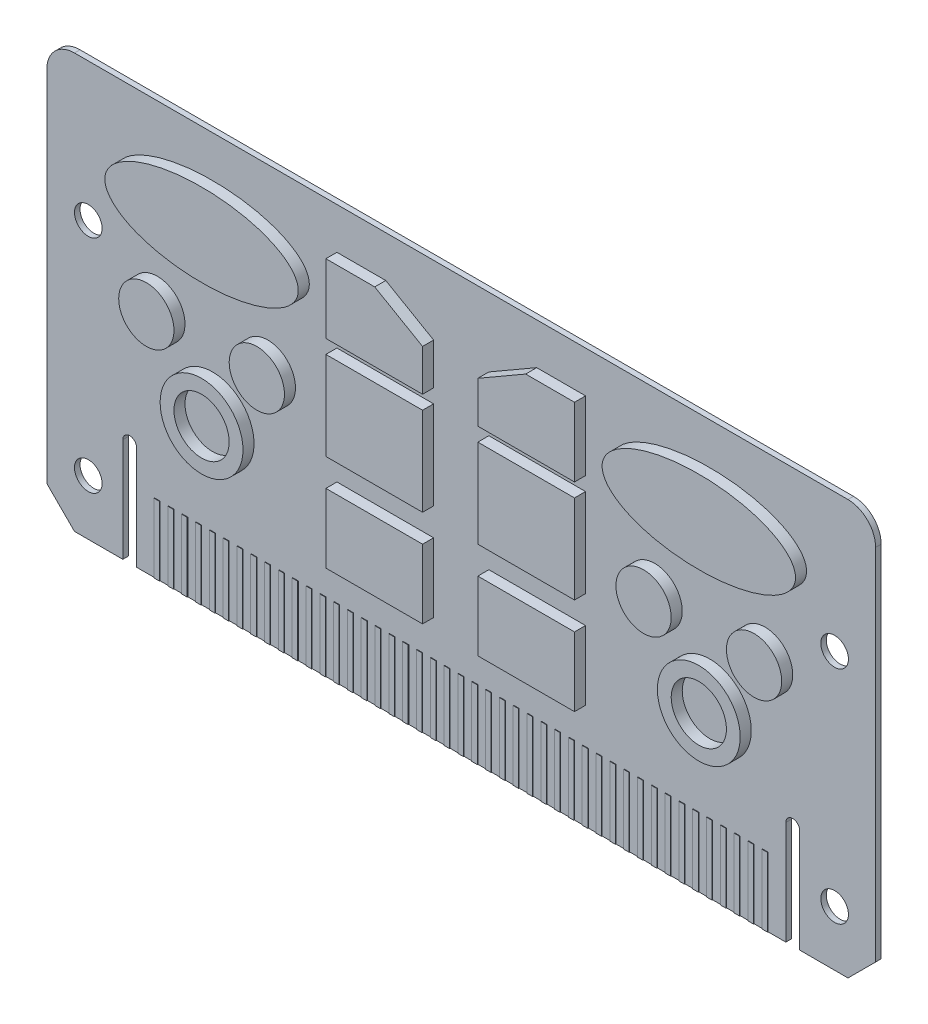
from build123d import *

# Parameters (mm, degrees)
SKETCH4_W                  = 300
SKETCH4_H                  = 150
PCB_BASE_DEPTH             = 1
SKETCH5_R                  = 10
SKETCH5_R_2                = 15
SKETCH5_RX                 = 35
SKETCH5_RY                 = 15
SKETCH5_W                  = 35
SKETCH5_H                  = 25
SKETCH5_H_2                = 32
PCB_CHIPS_DEPTH            = 4
SLOT_CUT_DEPTH             = 10
F_10_0MM_DOWEL_HOLE1_D     = 10
F_10_0MM_DOWEL_HOLE1_DEPTH = 10
F_10_0MM_DOWEL_HOLE1_TIP   = 3.004303095
SKETCH11_W                 = 2
SKETCH11_H                 = 25
CONTACT_DEPTH              = 0.2
CONTACT_PATTERN_COUNT      = 45
CONTACT_PATTERN_PITCH      = 5
CHAMFER1_SIZE              = 10
FILLET1_R                  = 10


with BuildPart() as part:
    # Sketch4 → PCB Base (new, symmetric)
    with BuildSketch(Plane.XY):
        with Locations((-150, 75)):
            Rectangle(SKETCH4_W, SKETCH4_H)
    extrude(amount=PCB_BASE_DEPTH, both=True)

    # Sketch5 → PCB Chips (add)
    # profile 1 of 14: a face of its own
    with BuildSketch(Plane.XY.offset(1)):
        with Locations(Location((-260, 85, 0), (0, 0, 180))):
            Circle(SKETCH5_R)
    # profile 2 of 14: a face of its own
    with BuildSketch(Plane.XY.offset(1)):
        with Locations(Location((-220, 85, 0), (0, 0, 180))):
            Circle(SKETCH5_R)
    # profile 3 of 14: a face of its own
    with BuildSketch(Plane.XY.offset(1)):
        with Locations(Location((-240, 60, 0), (0, 0, 180))):
            Circle(SKETCH5_R_2)
        with Locations((-240, 60)):
            Circle(SKETCH5_R, mode=Mode.SUBTRACT)
    # profile 4 of 14: a face of its own
    with BuildSketch(Plane.XY.offset(1)):
        with Locations(Location((-60, 60, 0), (0, 0, 180))):
            Circle(SKETCH5_R_2)
        with Locations(Location((-60, 60, 0), (0, 0, 180))):
            Circle(SKETCH5_R, mode=Mode.SUBTRACT)
    # profile 5 of 14: a face of its own
    with BuildSketch(Plane.XY.offset(1)):
        with Locations(Location((-80, 85, 0), (0, 0, 180))):
            Circle(SKETCH5_R)
    # profile 6 of 14: a face of its own
    with BuildSketch(Plane.XY.offset(1)):
        with Locations(Location((-40, 85, 0), (0, 0, 180))):
            Circle(SKETCH5_R)
    # profile 7 of 14: a face of its own
    with BuildSketch(Plane.XY.offset(1)):
        with Locations(Location((-240, 120), (0, 0, 180))):
            Ellipse(SKETCH5_RX, SKETCH5_RY)
    # profile 8 of 14: a face of its own
    with BuildSketch(Plane.XY.offset(1)):
        with Locations((-60, 120)):
            Ellipse(SKETCH5_RX, SKETCH5_RY)
    # profile 9 of 14: a face of its own
    with BuildSketch(Plane.XY.offset(1)):
        with Locations((-177.5, 50.5)):
            Rectangle(SKETCH5_W, SKETCH5_H)
    # profile 10 of 14: a face of its own
    with BuildSketch(Plane.XY.offset(1)):
        with Locations((-177.5, 89)):
            Rectangle(SKETCH5_W, SKETCH5_H_2)
    # profile 11 of 14: a face of its own
    with BuildSketch(Plane.XY.offset(1)):
        Polygon((-195, 110), (-160, 110), (-160, 125), (-177.320508076, 135), (-195, 135), align=None)
    # profile 12 of 14: a face of its own
    with BuildSketch(Plane.XY.offset(1)):
        Polygon((-140, 110), (-140, 125), (-122.679491924, 135), (-105, 135), (-105, 110), align=None)
    # profile 13 of 14: a face of its own
    with BuildSketch(Plane.XY.offset(1)):
        with Locations((-122.5, 50.5)):
            Rectangle(SKETCH5_W, SKETCH5_H)
    # profile 14 of 14: a face of its own
    with BuildSketch(Plane.XY.offset(1)):
        with Locations((-122.5, 89)):
            Rectangle(SKETCH5_W, SKETCH5_H_2)
    pcb_chips = extrude(amount=PCB_CHIPS_DEPTH)

    # Mirror1: PCB Chips across plane
    add(pcb_chips.mirror(Plane.XY))

    # Sketch6 → Slot Cut (cut)
    with BuildSketch(Plane.XY.offset(1)):
        with BuildLine():
            Line((-272.5, 37.5), (-272.5, 0))
            Line((-272.5, 0), (-267.5, 0))
            Line((-267.5, 0), (-267.5, 37.5))
            ThreePointArc((-267.5, 37.5), (-270, 40), (-272.5, 37.5))
        make_face()
        with BuildLine():
            Line((-32.5, 0), (-32.5, 37.5))
            ThreePointArc((-32.5, 37.5), (-30, 40), (-27.5, 37.5))
            Line((-27.5, 37.5), (-27.5, 0))
            ThreePointArc((-27.5, 0), (-30, -2.5), (-32.5, 0))
        make_face()
    extrude(amount=-SLOT_CUT_DEPTH, mode=Mode.SUBTRACT)

    # Ø10.0mm Dowel Hole1
    with Locations(Plane.XY.offset(1)):
        with Locations((-285, 100), (-285, 20), (-14.838485897, 20), (-14.838485897, 100)):
            Hole(F_10_0MM_DOWEL_HOLE1_D / 2, depth=F_10_0MM_DOWEL_HOLE1_DEPTH)
            with Locations((0, 0, -(F_10_0MM_DOWEL_HOLE1_DEPTH + F_10_0MM_DOWEL_HOLE1_TIP / 2))):  # 118° drill point
                Cone(0, F_10_0MM_DOWEL_HOLE1_D / 2, F_10_0MM_DOWEL_HOLE1_TIP, mode=Mode.SUBTRACT)

    # Sketch11 → Contact (add)
    with BuildSketch(Plane.XY.offset(1)):
        with Locations((-260, 12.5)):
            Rectangle(SKETCH11_W, SKETCH11_H)
    contact = extrude(amount=CONTACT_DEPTH)

    # Contact Pattern: Contact ×45
    with Locations(*[(i * CONTACT_PATTERN_PITCH, 0, 0) for i in range(1, CONTACT_PATTERN_COUNT)]):
        add(contact)

    # Chamfer1
    chamfer1_edges = [part.edges().sort_by_distance(p)[0] for p in [
        (-300, 0, 0),
        (0, 0, 0),
    ]]
    chamfer(chamfer1_edges, length=CHAMFER1_SIZE)

    # Fillet1
    fillet1_edges = [part.edges().sort_by_distance(p)[0] for p in [
        (-300, 150, 0),
        (0, 150, 0),
    ]]
    fillet(fillet1_edges, radius=FILLET1_R)


solid = part.part
